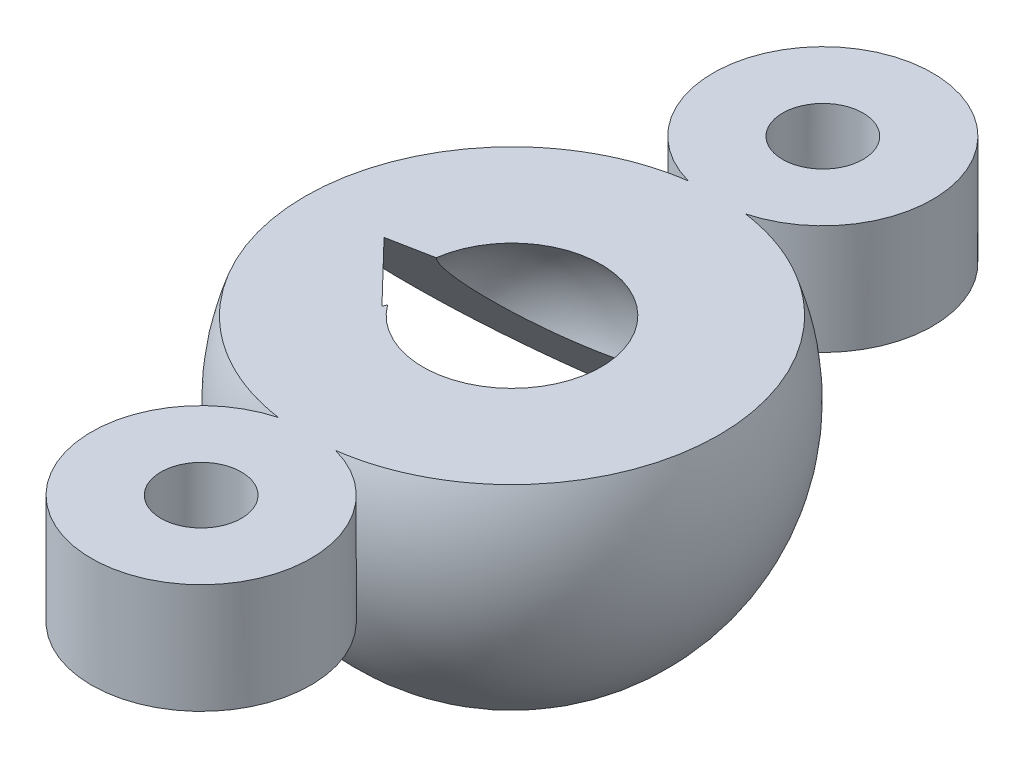
from build123d import *

# Parameters (mm, degrees)
RETAINER_FEATURE_2_PROFILE_W = 14
RETAINER_FEATURE_2_PROFILE_H = 5
RETAINER_FEATURE_2_DEPTH     = 14
RETAINER_FEATURE_3_PROFILE_R = 3
RETAINER_FEATURE_3_DEPTH     = 3
RETAINER_FEATURE_4_PROFILE_R = 3
RETAINER_FEATURE_4_DEPTH     = 3
RETAINER_FEATURE_6_PROFILE_R = 1.1
RETAINER_FEATURE_6_DEPTH     = 4.25
RETAINER_FEATURE_7_PROFILE_R = 2.1
RETAINER_FEATURE_7_DEPTH     = 1.45
RETAINER_FEATURE_8_PROFILE_R = 1.1
RETAINER_FEATURE_8_DEPTH     = 4.25
RETAINER_FEATURE_9_PROFILE_R = 2.1
RETAINER_FEATURE_9_DEPTH     = 1.45
RETAINER_FEATURE_12_DEPTH    = 10


with BuildPart() as part:
    # Retainer Feature 1 profile → Retainer Feature 1 (revolve)
    with BuildSketch(Plane(origin=(0, -73, 0), x_dir=(-1, 0, 0), z_dir=(0, -1, 0))):
        with BuildLine():
            Line((26.291651246, -6), (26.291651246, 6))
            ThreePointArc((26.291651246, 6), (20.291651246, 0), (26.291651246, -6))
        make_face()
    revolve(axis=Axis((-26.291651246, -73, -10), (0, 0, 1)))

    # Retainer Feature 2 profile → Retainer Feature 2 (cut)
    with BuildSketch(Plane.XY.offset(-7)):
        with Locations((-26.291651246, -68.5)):
            Rectangle(RETAINER_FEATURE_2_PROFILE_W, RETAINER_FEATURE_2_PROFILE_H)
    extrude(amount=RETAINER_FEATURE_2_DEPTH, mode=Mode.SUBTRACT)

    # Retainer Feature 3 profile → Retainer Feature 3 (add)
    with BuildSketch(Plane(origin=(0, -71, 0), x_dir=(-1, 0, 0), z_dir=(0, -1, 0))):
        with Locations((26.291651246, 8.5)):
            Circle(RETAINER_FEATURE_3_PROFILE_R)
    extrude(amount=RETAINER_FEATURE_3_DEPTH)

    # Retainer Feature 4 profile → Retainer Feature 4 (add)
    with BuildSketch(Plane(origin=(0, -71, 0), x_dir=(-1, 0, 0), z_dir=(0, -1, 0))):
        with Locations((26.291651246, -8.5)):
            Circle(RETAINER_FEATURE_4_PROFILE_R)
    extrude(amount=RETAINER_FEATURE_4_DEPTH)

    # Retainer Feature 5 profile → Retainer Feature 5 (revolve, cut)
    with BuildSketch(Plane(origin=(0, -73, 0), x_dir=(-1, 0, 0), z_dir=(0, -1, 0))):
        with BuildLine():
            Line((26.291651246, -3.15), (26.291651246, 3.15))
            ThreePointArc((26.291651246, 3.15), (23.141651246, 0), (26.291651246, -3.15))
        make_face()
    revolve(axis=Axis((-26.291651246, -73, -10), (0, 0, 1)), mode=Mode.SUBTRACT)

    # Retainer Feature 6 profile → Retainer Feature 6 (cut)
    with BuildSketch(Plane(origin=(0, -70, 0), x_dir=(-1, 0, 0), z_dir=(0, -1, 0))):
        with Locations(Location((26.291651246, 8.5, 0), (0, 0, 270))):
            Circle(RETAINER_FEATURE_6_PROFILE_R)
    extrude(amount=RETAINER_FEATURE_6_DEPTH, mode=Mode.SUBTRACT)

    # Retainer Feature 7 profile → Retainer Feature 7 (cut)
    with BuildSketch(Plane(origin=(0, -72.8, 0), x_dir=(-1, 0, 0), z_dir=(0, -1, 0))):
        with Locations(Location((26.291651246, 8.5, 0), (0, 0, 90))):
            Circle(RETAINER_FEATURE_7_PROFILE_R)
    extrude(amount=RETAINER_FEATURE_7_DEPTH, mode=Mode.SUBTRACT)

    # Retainer Feature 8 profile → Retainer Feature 8 (cut)
    with BuildSketch(Plane(origin=(0, -70, 0), x_dir=(-1, 0, 0), z_dir=(0, -1, 0))):
        with Locations(Location((26.291651246, -8.5, 0), (0, 0, 270))):
            Circle(RETAINER_FEATURE_8_PROFILE_R)
    extrude(amount=RETAINER_FEATURE_8_DEPTH, mode=Mode.SUBTRACT)

    # Retainer Feature 9 profile → Retainer Feature 9 (cut)
    with BuildSketch(Plane(origin=(0, -72.8, 0), x_dir=(-1, 0, 0), z_dir=(0, -1, 0))):
        with Locations(Location((26.291651246, -8.5, 0), (0, 0, 90))):
            Circle(RETAINER_FEATURE_9_PROFILE_R)
    extrude(amount=RETAINER_FEATURE_9_DEPTH, mode=Mode.SUBTRACT)

    # Middle Right Fixed Compression Ball Reta → Retainer Feature 12 (cut)
    with BuildSketch(Plane(origin=(-46.801806266, -32.220261504, -18.815460044), x_dir=(-0.25892602820646665, -0.17825517869277457, 0.9493062747008634), z_dir=(-0.7819246728070284, -0.5383086561091627, -0.3143526631246647))):
        Polygon((20.297287002, -41.528985171), (16.35135873, -46.567799523), (19.343154751, -48.910694434), (23.289083023, -43.871880083), align=None)
    extrude(amount=RETAINER_FEATURE_12_DEPTH, mode=Mode.SUBTRACT)


solid = part.part
